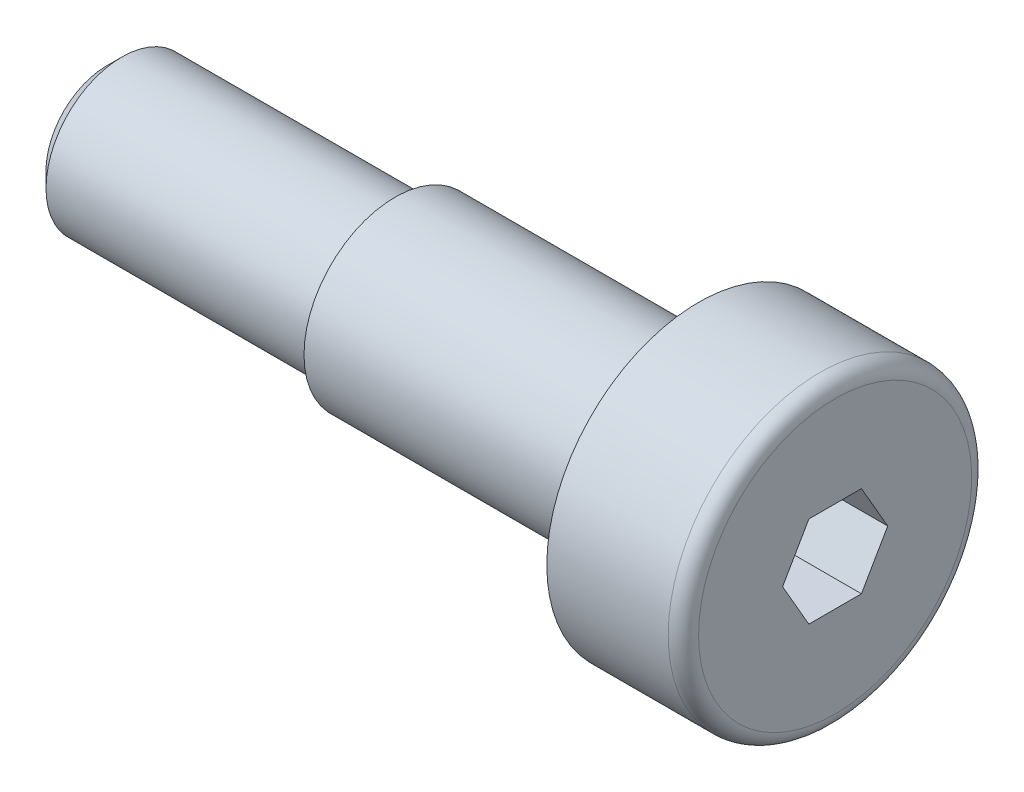
from build123d import *

# Parameters (mm, degrees)
CHAMFER1_SIZE      = 0.5
CUT_EXTRUDE1_DEPTH = 2.4


with BuildPart() as part:
    # Sketch1 → Revolve1 (revolve)
    with BuildSketch(Plane.XY):
        with BuildLine():
            Line((0, 0), (0, 4.5))
            ThreePointArc((0, 4.5), (-0.146446609, 4.853553391), (-0.5, 5))
            Line((-0.5, 5), (-4.5, 5))
            Line((-4.5, 5), (-4.5, 3))
            Line((-4.5, 3), (-14.5, 3))
            Line((-14.5, 3), (-14.5, 2.5))
            Line((-14.5, 2.5), (-24, 2.5))
            Line((-24, 2.5), (-24, 0))
            Line((-24, 0), (0, 0))
        make_face()
    revolve(axis=Axis((0, 0, 0), (1, 0, 0)))

    # Chamfer1
    chamfer1_edges = [part.edges().sort_by_distance(p)[0] for p in [
        (-24, -2.5, 0),
    ]]
    chamfer(chamfer1_edges, length=CHAMFER1_SIZE)

    # Sketch2 → Cut-Extrude1 (cut)
    with BuildSketch(Plane(origin=(0, 0, 0), x_dir=(0, 0, -1), z_dir=(1, 0, 0))):
        Polygon((1.732050808, 0), (0.866025404, 1.5), (-0.866025404, 1.5), (-1.732050808, 0), (-0.866025404, -1.5), (0.866025404, -1.5), align=None)
    extrude(amount=-CUT_EXTRUDE1_DEPTH, mode=Mode.SUBTRACT)


solid = part.part
